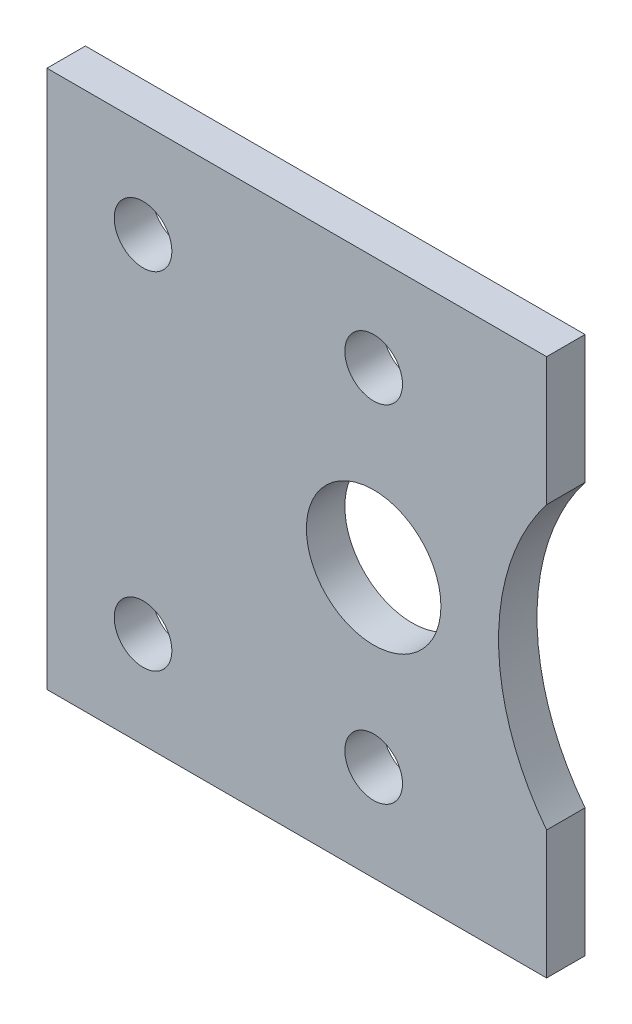
from build123d import *

# Parameters (mm, degrees)
SKETCH1_R           = 1.5
SKETCH1_R_2         = 3.5
BOSS_EXTRUDE1_DEPTH = 2


with BuildPart() as part:
    # Sketch1 → Boss-Extrude1 (new body)
    with BuildSketch(Plane.XY):
        with BuildLine():
            Line((9, -14), (9, -7.331439149))
            ThreePointArc((9, -7.331439149), (6.5, 0), (9, 7.331439149))
            Line((9, 7.331439149), (9, 14))
            Line((9, 14), (-17, 14))
            Line((-17, 14), (-17, -9))
            Line((-17, -9), (-17, -14))
            Line((-17, -14), (9, -14))
        make_face()
        with Locations((-12, -9)):
            Circle(SKETCH1_R, mode=Mode.SUBTRACT)
        with Locations((0, -9)):
            Circle(SKETCH1_R, mode=Mode.SUBTRACT)
        with Locations((-12, 9)):
            Circle(SKETCH1_R, mode=Mode.SUBTRACT)
        Circle(SKETCH1_R_2, mode=Mode.SUBTRACT)
        with Locations((0, 9)):
            Circle(SKETCH1_R, mode=Mode.SUBTRACT)
    extrude(amount=BOSS_EXTRUDE1_DEPTH)


solid = part.part
